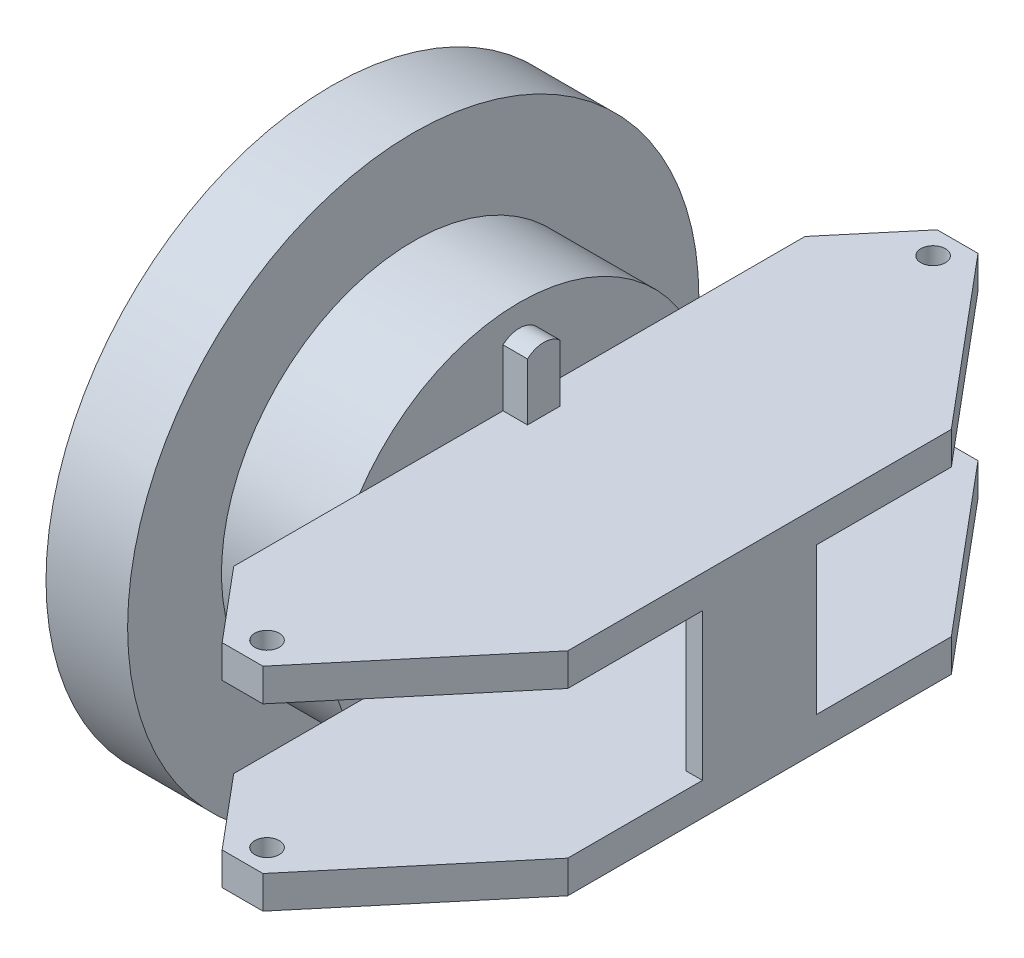
from build123d import *

# Parameters (mm, degrees)
SKETCH1_R               = 35
BOSS_EXTRUDE1_DEPTH     = 10
SKETCH2_R               = 23.5
BOSS_EXTRUDE2_DEPTH     = 13
BOSS_EXTRUDE3_DEPTH     = 4
SKETCH4_R               = 1.5
CUT_EXTRUDE1_DEPTH      = 4
MIRROR2_COPY_1_SKETCH_R = 1.5
MIRROR2_COPY_1_DEPTH    = 4
BOSS_EXTRUDE4_DEPTH     = 3
SKETCH6_W               = 14
SKETCH6_H               = 26
BOSS_EXTRUDE5_DEPTH     = 2
SKETCH7_R               = 10
CUT_EXTRUDE2_DEPTH      = 10


with BuildPart() as part:
    # Sketch1 → Boss-Extrude1 (new body)
    with BuildSketch(Plane(origin=(0, 0, 0), x_dir=(0, 0, -1), z_dir=(1, 0, 0))):
        Circle(SKETCH1_R)
    extrude(amount=BOSS_EXTRUDE1_DEPTH)

    # Sketch2 → Boss-Extrude2 (add)
    with BuildSketch(Plane(origin=(10, 0, 0), x_dir=(0, 0, -1), z_dir=(1, 0, 0))):
        with Locations(Location((0, 0, 0), (0, 0, 180))):
            Circle(SKETCH2_R)
    extrude(amount=BOSS_EXTRUDE2_DEPTH)

    # Sketch3 → Boss-Extrude3 (add)
    with BuildSketch(Plane(origin=(0, 13, 0), x_dir=(1, 0, 0), z_dir=(0, 1, 0))):
        Polygon((23, 35), (23, -35), (30.392057511, -43.809511096), (35.392057511, -43.809511096), (52.433760781, -23.5), (52.433760781, 23.5), (35.392057511, 43.809511096), (30.392057511, 43.809511096), align=None)
    boss_extrude3 = extrude(amount=-BOSS_EXTRUDE3_DEPTH)

    # Sketch4 → Cut-Extrude1 (cut)
    with BuildSketch(Plane(origin=(0, 13, 0), x_dir=(1, 0, 0), z_dir=(0, 1, 0))):
        with Locations(Location((32.892057511, -40.809511096, 0), (0, 0, 270))):
            Circle(SKETCH4_R)
    cut_extrude1 = extrude(amount=-CUT_EXTRUDE1_DEPTH, mode=Mode.SUBTRACT)

    # Mirror1: Cut-Extrude1 across plane
    add(cut_extrude1.mirror(Plane.XY), mode=Mode.SUBTRACT)

    # Mirror2: Boss-Extrude3, Cut-Extrude1 across plane
    add(boss_extrude3.mirror(Plane.ZX))
    add(cut_extrude1.mirror(Plane.ZX), mode=Mode.SUBTRACT)

    # Mirror2 copy 1 sketch → Mirror2 copy 1 (cut)
    with BuildSketch(Plane.XZ.offset(13)):
        with Locations(Location((32.892057511, -40.809511096, 0), (0, 0, 270))):
            Circle(MIRROR2_COPY_1_SKETCH_R)
    extrude(amount=-MIRROR2_COPY_1_DEPTH, mode=Mode.SUBTRACT)

    # Sketch5 → Boss-Extrude4 (add)
    with BuildSketch(Plane(origin=(23, 0, 0), x_dir=(0, 0, -1), z_dir=(1, 0, 0))):
        with BuildLine():
            Line((-2, 13), (-2, 20))
            ThreePointArc((-2, 20), (0, 20.763932023), (2, 20))
            Line((2, 20), (2, 13))
            Line((2, 13), (-2, 13))
        make_face()
    boss_extrude4 = extrude(amount=BOSS_EXTRUDE4_DEPTH)

    # Mirror3: Boss-Extrude4 across plane
    add(boss_extrude4.mirror(Plane.ZX))

    # Sketch6 → Boss-Extrude5 (add)
    with BuildSketch(Plane(origin=(52.433760781, 0, 0), x_dir=(0, 0, -1), z_dir=(1, 0, 0))):
        Rectangle(SKETCH6_W, SKETCH6_H)
    extrude(amount=-BOSS_EXTRUDE5_DEPTH)

    # Sketch7 → Cut-Extrude2 (cut)
    with BuildSketch(Plane.ZY):
        Circle(SKETCH7_R)
    extrude(amount=-CUT_EXTRUDE2_DEPTH, mode=Mode.SUBTRACT)


solid = part.part
